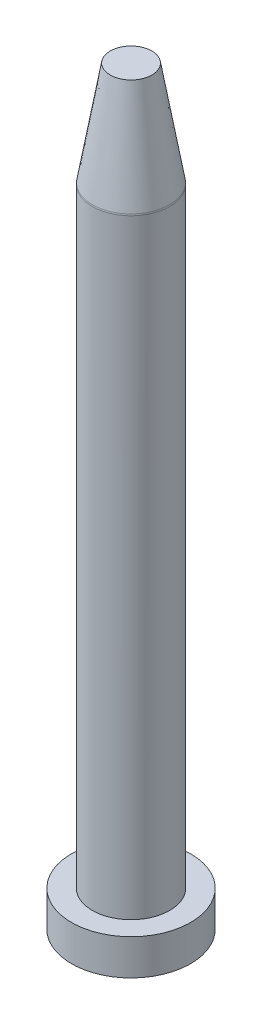
from build123d import *

# Parameters (mm, degrees)
FILLET_1_R = 3


with BuildPart() as part:
    # 草图1 → Revolve 297 (revolve)
    with BuildSketch(Plane.XY, mode=Mode.PRIVATE) as revolve_297_sk:
        Polygon((0, 0), (20, 0), (20, 12), (13, 12), (13, 217), (7, 252), (0, 252), align=None)
    revolve(revolve_297_sk.sketch.rotate(Axis((0, 0, 0), (0, 1, 0)), 90), axis=Axis((0, 0, 0), (0, 1, 0)))

    # 圆角1
    fillet_1_edges = [part.edges().sort_by_distance(p)[0] for p in [
        (0, 217, 13),
    ]]
    fillet(fillet_1_edges, radius=FILLET_1_R)


solid = part.part
